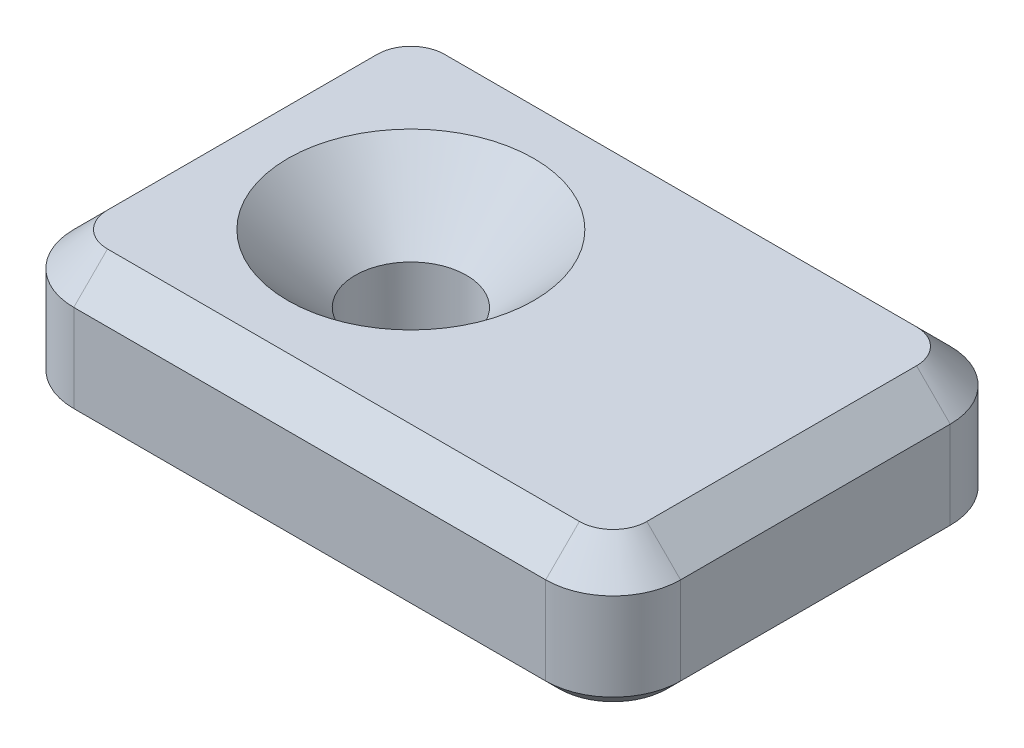
from build123d import *

# Parameters (mm, degrees)
SKETCH_1_R      = 1.65
EXTRUDE_1_DEPTH = 4
CHAMFER_1_SIZE  = 2
CHAMFER_2_SIZE  = 1
CHAMFER_3_SIZE  = 0.4


with BuildPart() as part:
    # 草图1 → 凸台-拉伸1 (new body)
    with BuildSketch(Plane(origin=(0, 0, 0), x_dir=(1, 0, 0), z_dir=(0, 1, 0))):
        with BuildLine():
            Line((2, 0), (16, 0))
            ThreePointArc((16, 0), (17.414213562, 0.585786438), (18, 2))
            Line((18, 2), (18, 10))
            ThreePointArc((18, 10), (17.414213562, 11.414213562), (16, 12))
            Line((16, 12), (2, 12))
            ThreePointArc((2, 12), (0.585786438, 11.414213562), (0, 10))
            Line((0, 10), (0, 2))
            ThreePointArc((0, 2), (0.585786438, 0.585786438), (2, 0))
        make_face()
        with Locations(Location((6, 6, 0), (0, 0, 270))):
            Circle(SKETCH_1_R, mode=Mode.SUBTRACT)
    extrude(amount=EXTRUDE_1_DEPTH)

    # 倒角1
    chamfer_1_edges = [part.edges().sort_by_distance(p)[0] for p in [
        (6, 4, -7.65),
    ]]
    chamfer(chamfer_1_edges, length=CHAMFER_1_SIZE)

    # 倒角2
    chamfer_2_edges = [part.edges().sort_by_distance(p)[0] for p in [
        (0.585786438, 4, -11.414213562),
        (0, 4, -6),
        (0.585786438, 4, -0.585786438),
        (9, 4, 0),
        (17.414213562, 4, -0.585786438),
        (18, 4, -6),
        (17.414213562, 4, -11.414213562),
        (9, 4, -12),
    ]]
    chamfer(chamfer_2_edges, length=CHAMFER_2_SIZE)

    # 倒角3
    chamfer_3_edges = [part.edges().sort_by_distance(p)[0] for p in [
        (0, 0, -6),
        (0.585786438, 0, -11.414213562),
        (9, 0, -12),
        (17.414213562, 0, -11.414213562),
        (18, 0, -6),
        (17.414213562, 0, -0.585786438),
        (9, 0, 0),
        (0.585786438, 0, -0.585786438),
    ]]
    chamfer(chamfer_3_edges, length=CHAMFER_3_SIZE)


solid = part.part
